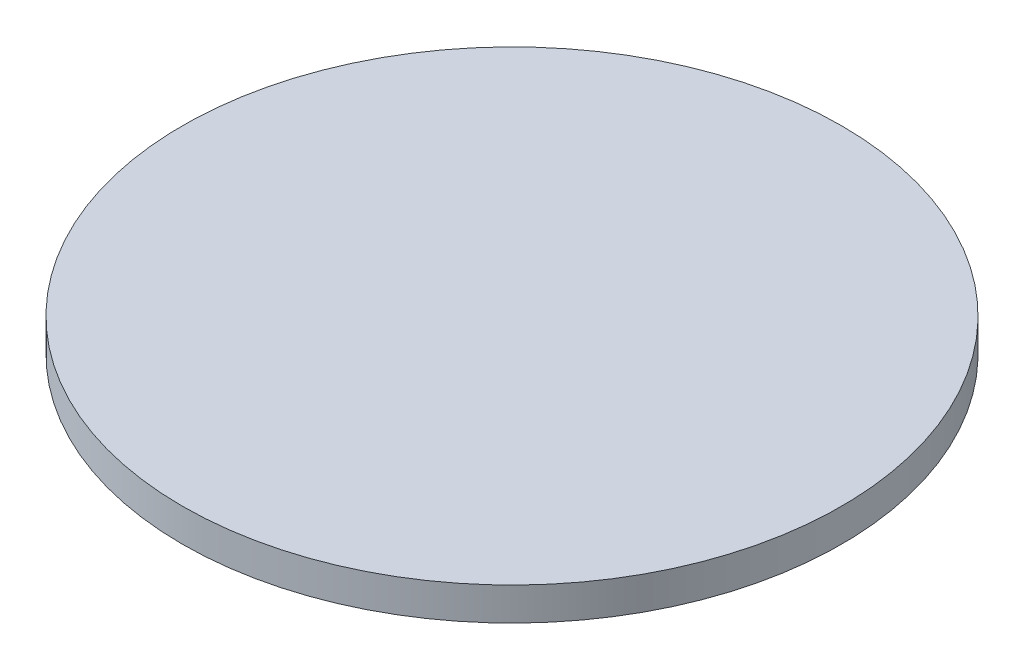
from build123d import *

# Parameters (mm, degrees)
SKETCH_1_R      = 20
EXTRUDE_1_DEPTH = 1


with BuildPart() as part:
    # 草图1 → 凸台-拉伸1 (new, symmetric)
    with BuildSketch(Plane(origin=(0, 0, 0), x_dir=(1, 0, 0), z_dir=(0, 1, 0))):
        with Locations(Location((0, 0, 0), (0, 0, 270))):
            Circle(SKETCH_1_R)
    extrude(amount=EXTRUDE_1_DEPTH, both=True)


solid = part.part
